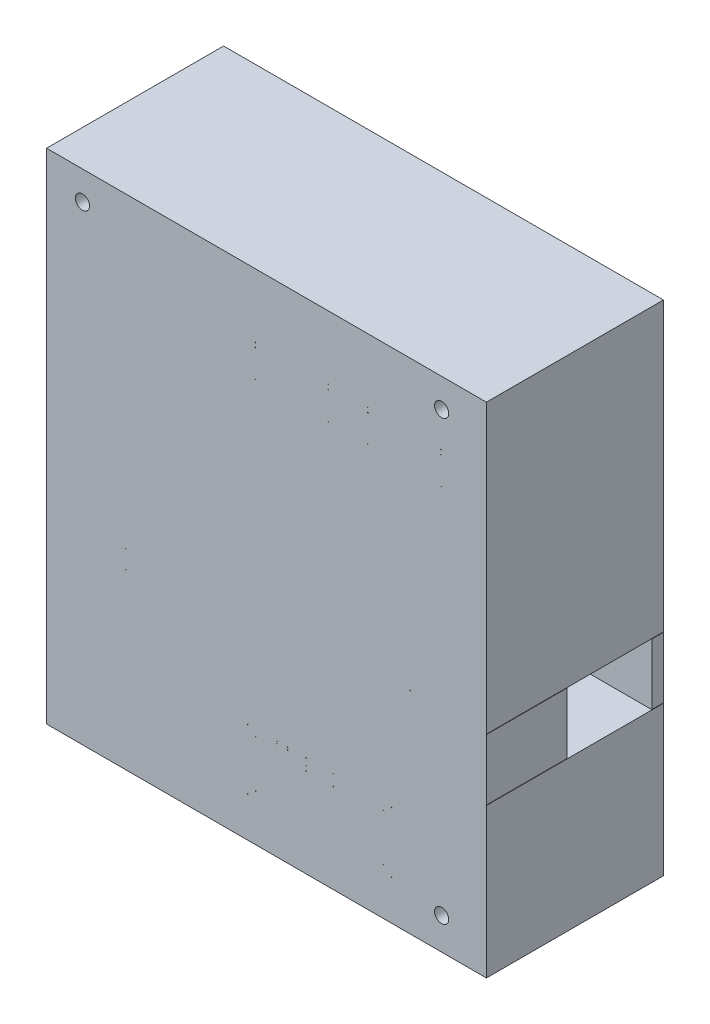
from build123d import *

# Parameters (mm, degrees)
PLACA_EAGLE_R           = 1.29032
PLACA_EAGLE_R_2         = 25.07
BOSS_EXTRUDE2_DEPTH     = 625.925
CUT_EXTRUDE2_DEPTH      = 867.925
CUT_EXTRUDE2_DEPTH_BACK = 6230
SKETCH2_W               = 508
SKETCH2_H               = 213.36
SKETCH2_W_2             = 161.293173733
SKETCH2_H_2             = 150.42
CUT_EXTRUDE3_DEPTH      = 1935.925
CUT_EXTRUDE3_DEPTH_BACK = 20
BOSS_EXTRUDE3_DEPTH     = 507.925
SCALE2_SCALE            = 0.039888313


with BuildPart() as part:
    # Placa Eagle → Boss-Extrude2 (new body)
    with BuildSketch(Plane.XY):
        with BuildLine():
            Line((0, 1752.6), (0, -10.668))
            Line((0, -10.668), (1555.242, -10.668))
            Line((1555.242, -10.668), (1555.242, 517.63168))
            ThreePointArc((1555.242, 517.63168), (1554.329605978, 518.009605978), (1553.95168, 518.922))
            Line((1553.95168, 518.922), (1555.242, 518.922))
            Line((1555.242, 518.922), (1555.242, 732.26168))
            Line((1555.242, 732.26168), (1555.242, 734.822))
            Line((1555.242, 734.822), (1553.95168, 734.822))
            ThreePointArc((1553.95168, 734.822), (1554.329605978, 735.734394022), (1555.242, 736.11232))
            Line((1555.242, 736.11232), (1555.242, 1752.6))
            Line((1555.242, 1752.6), (0, 1752.6))
        make_face()
        with BuildLine():
            ThreePointArc((1286.002, 733.53168), (1285.089605978, 735.734394022), (1287.29232, 734.822))
            Line((1287.29232, 734.822), (1286.002, 734.822))
            Line((1286.002, 734.822), (1286.002, 733.53168))
        make_face(mode=Mode.SUBTRACT)
        with BuildLine():
            ThreePointArc((279.35682, 666.75), (280.16327, 667.55645), (280.96972, 666.75))
            Line((280.96972, 666.75), (280.162, 666.75))
            Line((280.162, 666.75), (280.162, 665.94482))
            ThreePointArc((280.162, 665.94482), (279.592651762, 666.180651762), (279.35682, 666.75))
        make_face(mode=Mode.SUBTRACT)
        with BuildLine():
            ThreePointArc((279.35682, 602.234), (279.592651762, 602.803348238), (280.162, 603.03918))
            Line((280.162, 603.03918), (280.162, 602.234))
            Line((280.162, 602.234), (280.96972, 602.234))
            ThreePointArc((280.96972, 602.234), (280.16327, 601.42755), (279.35682, 602.234))
        make_face(mode=Mode.SUBTRACT)
        with BuildLine():
            ThreePointArc((1219.454, 131.84632), (1220.366394022, 129.643605978), (1218.16368, 130.556))
            Line((1218.16368, 130.556), (1219.454, 130.556))
            Line((1219.454, 130.556), (1219.454, 131.84632))
        make_face(mode=Mode.SUBTRACT)
        with BuildLine():
            ThreePointArc((1218.16368, 343.916), (1220.366394022, 344.828394022), (1219.454, 342.62568))
            Line((1219.454, 342.62568), (1219.454, 343.916))
            Line((1219.454, 343.916), (1218.16368, 343.916))
        make_face(mode=Mode.SUBTRACT)
        with Locations((1013.2822, 343.916)):
            Circle(PLACA_EAGLE_R, mode=Mode.SUBTRACT)
        with Locations((917.6258, 343.916)):
            Circle(PLACA_EAGLE_R, mode=Mode.SUBTRACT)
        with BuildLine():
            ThreePointArc((852.1954, 342.62568), (851.283005978, 344.828394022), (853.48572, 343.916))
            Line((853.48572, 343.916), (852.1954, 343.916))
            Line((852.1954, 343.916), (852.1954, 342.62568))
        make_face(mode=Mode.SUBTRACT)
        with BuildLine():
            Line((852.1954, 336.296), (852.1954, 337.58632))
            ThreePointArc((852.1954, 337.58632), (853.107794022, 335.383605978), (850.90508, 336.296))
            Line((850.90508, 336.296), (852.1954, 336.296))
        make_face(mode=Mode.SUBTRACT)
        with BuildLine():
            Line((814.6288, 336.296), (815.91912, 336.296))
            ThreePointArc((815.91912, 336.296), (813.716405978, 335.383605978), (814.6288, 337.58632))
            Line((814.6288, 337.58632), (814.6288, 336.296))
        make_face(mode=Mode.SUBTRACT)
        with BuildLine():
            ThreePointArc((813.33848, 343.916), (815.541194022, 344.828394022), (814.6288, 342.62568))
            Line((814.6288, 342.62568), (814.6288, 343.916))
            Line((814.6288, 343.916), (813.33848, 343.916))
        make_face(mode=Mode.SUBTRACT)
        with BuildLine():
            ThreePointArc((711.454, 342.62568), (710.541605978, 344.828394022), (712.74432, 343.916))
            Line((712.74432, 343.916), (711.454, 343.916))
            Line((711.454, 343.916), (711.454, 342.62568))
        make_face(mode=Mode.SUBTRACT)
        with BuildLine():
            ThreePointArc((712.74432, 130.556), (710.541605978, 129.643605978), (711.454, 131.84632))
            Line((711.454, 131.84632), (711.454, 130.556))
            Line((711.454, 130.556), (712.74432, 130.556))
        make_face(mode=Mode.SUBTRACT)
        with Locations((1397, 101.6)):
            Circle(PLACA_EAGLE_R_2, mode=Mode.SUBTRACT)
        with Locations((127, 1651)):
            Circle(PLACA_EAGLE_R_2, mode=Mode.SUBTRACT)
        with BuildLine():
            ThreePointArc((996.188, 1415.43532), (997.100394022, 1413.232605978), (994.89768, 1414.145))
            Line((994.89768, 1414.145), (996.188, 1414.145))
            Line((996.188, 1414.145), (996.188, 1415.43532))
        make_face(mode=Mode.SUBTRACT)
        with Locations((996.188, 1510.919)):
            Circle(PLACA_EAGLE_R, mode=Mode.SUBTRACT)
        with BuildLine():
            ThreePointArc((994.89768, 1527.048), (997.100394022, 1527.960394022), (996.188, 1525.75768))
            Line((996.188, 1525.75768), (996.188, 1527.048))
            Line((996.188, 1527.048), (994.89768, 1527.048))
        make_face(mode=Mode.SUBTRACT)
        with BuildLine():
            ThreePointArc((738.124, 1525.75768), (737.211605978, 1527.960394022), (739.41432, 1527.048))
            Line((739.41432, 1527.048), (738.124, 1527.048))
            Line((738.124, 1527.048), (738.124, 1525.75768))
        make_face(mode=Mode.SUBTRACT)
        with Locations((738.124, 1510.919)):
            Circle(PLACA_EAGLE_R, mode=Mode.SUBTRACT)
        with BuildLine():
            ThreePointArc((739.41432, 1414.145), (737.211605978, 1413.232605978), (738.124, 1415.43532))
            Line((738.124, 1415.43532), (738.124, 1414.145))
            Line((738.124, 1414.145), (739.41432, 1414.145))
        make_face(mode=Mode.SUBTRACT)
        with BuildLine():
            ThreePointArc((1394.46, 1415.43532), (1395.372394022, 1413.232605978), (1393.16968, 1414.145))
            Line((1393.16968, 1414.145), (1394.46, 1414.145))
            Line((1394.46, 1414.145), (1394.46, 1415.43532))
        make_face(mode=Mode.SUBTRACT)
        with Locations((1394.46, 1510.919)):
            Circle(PLACA_EAGLE_R, mode=Mode.SUBTRACT)
        with BuildLine():
            ThreePointArc((1393.16968, 1527.048), (1395.372394022, 1527.960394022), (1394.46, 1525.75768))
            Line((1394.46, 1525.75768), (1394.46, 1527.048))
            Line((1394.46, 1527.048), (1393.16968, 1527.048))
        make_face(mode=Mode.SUBTRACT)
        with BuildLine():
            ThreePointArc((1136.396, 1525.75768), (1135.483605978, 1527.960394022), (1137.68632, 1527.048))
            Line((1137.68632, 1527.048), (1136.396, 1527.048))
            Line((1136.396, 1527.048), (1136.396, 1525.75768))
        make_face(mode=Mode.SUBTRACT)
        with Locations((1136.396, 1510.919)):
            Circle(PLACA_EAGLE_R, mode=Mode.SUBTRACT)
        with BuildLine():
            ThreePointArc((1137.68632, 1414.145), (1135.483605978, 1413.232605978), (1136.396, 1415.43532))
            Line((1136.396, 1415.43532), (1136.396, 1414.145))
            Line((1136.396, 1414.145), (1137.68632, 1414.145))
        make_face(mode=Mode.SUBTRACT)
        with Locations((1397, 1651)):
            Circle(PLACA_EAGLE_R_2, mode=Mode.SUBTRACT)
        with BuildLine():
            Line((1013.2822, 321.71132), (1013.2822, 319.13068))
            ThreePointArc((1013.2822, 319.13068), (1011.99188, 320.421), (1013.2822, 321.71132))
        make_face(mode=Mode.SUBTRACT)
        with BuildLine():
            ThreePointArc((917.6258, 321.71132), (918.91612, 320.421), (917.6258, 319.13068))
            Line((917.6258, 319.13068), (917.6258, 321.71132))
        make_face(mode=Mode.SUBTRACT)
        with BuildLine():
            ThreePointArc((740.029, 319.13068), (739.116605978, 321.333394022), (741.31932, 320.421))
            Line((741.31932, 320.421), (740.029, 320.421))
            Line((740.029, 320.421), (740.029, 319.13068))
        make_face(mode=Mode.SUBTRACT)
        with BuildLine():
            ThreePointArc((741.31932, 154.051), (739.116605978, 153.138605978), (740.029, 155.34132))
            Line((740.029, 155.34132), (740.029, 154.051))
            Line((740.029, 154.051), (741.31932, 154.051))
        make_face(mode=Mode.SUBTRACT)
        with BuildLine():
            ThreePointArc((1190.879, 155.34132), (1191.791394022, 153.138605978), (1189.58868, 154.051))
            Line((1189.58868, 154.051), (1190.879, 154.051))
            Line((1190.879, 154.051), (1190.879, 155.34132))
        make_face(mode=Mode.SUBTRACT)
        with BuildLine():
            ThreePointArc((1189.58868, 320.421), (1191.791394022, 321.333394022), (1190.879, 319.13068))
            Line((1190.879, 319.13068), (1190.879, 320.421))
            Line((1190.879, 320.421), (1189.58868, 320.421))
        make_face(mode=Mode.SUBTRACT)
        with BuildLine():
            Line((1013.2822, 304.546), (1013.2822, 305.83632))
            ThreePointArc((1013.2822, 305.83632), (1014.194594022, 303.633605978), (1011.99188, 304.546))
            Line((1011.99188, 304.546), (1013.2822, 304.546))
        make_face(mode=Mode.SUBTRACT)
        with BuildLine():
            Line((917.6258, 304.546), (918.91612, 304.546))
            ThreePointArc((918.91612, 304.546), (916.713405978, 303.633605978), (917.6258, 305.83632))
            Line((917.6258, 305.83632), (917.6258, 304.546))
        make_face(mode=Mode.SUBTRACT)
    extrude(amount=BOSS_EXTRUDE2_DEPTH)

    # Sketch2 → Cut-Extrude2 (cut, two sides: drawn at the far end of the back side and taken through both)
    with BuildSketch(Plane(origin=(0, 0, 0), x_dir=(1, 0, 0), z_dir=(0, 1, 0)).offset(-CUT_EXTRUDE2_DEPTH_BACK)):
        with Locations((965.451281541, -146.796113061)):
            Rectangle(SKETCH2_W, SKETCH2_H)
        with Locations((312.419266578, -451.26)):
            Rectangle(SKETCH2_W_2, SKETCH2_H_2)
    extrude(amount=CUT_EXTRUDE2_DEPTH + CUT_EXTRUDE2_DEPTH_BACK, mode=Mode.SUBTRACT)

    # Sketch11 → Cut-Extrude3 (cut, two sides: drawn at the far end of the back side and taken through both)
    with BuildSketch(Plane(origin=(0, 0, 0), x_dir=(0, 0, -1), z_dir=(1, 0, 0)).offset(-CUT_EXTRUDE3_DEPTH_BACK)):
        Polygon((-40.112, 626.872), (-40.112, 736.11232), (-193.194582669, 736.11232), (-340.952, 736.11232), (-340.952, 626.872), (-340.952, 517.63168), (-40.112, 517.63168), align=None)
    extrude(amount=CUT_EXTRUDE3_DEPTH + CUT_EXTRUDE3_DEPTH_BACK, mode=Mode.SUBTRACT)

    # Sketch11<2> → Boss-Extrude3 (add)
    with BuildSketch(Plane(origin=(0, 0, 0), x_dir=(0, 0, -1), z_dir=(1, 0, 0))):
        Polygon((-40.112, 626.872), (-40.112, 736.11232), (-193.194582669, 736.11232), (-340.952, 736.11232), (-340.952, 626.872), (-340.952, 517.63168), (-40.112, 517.63168), align=None)
    extrude(amount=BOSS_EXTRUDE3_DEPTH)


with BuildPart() as part_1:
    # Scale2: scaled about (763.599702708, 910.679608748, 324.159274525)
    add(part.part.scale(SCALE2_SCALE).moved(Location((733.14099897, 874.354135723, 311.22910801))))


solid = part_1.part
